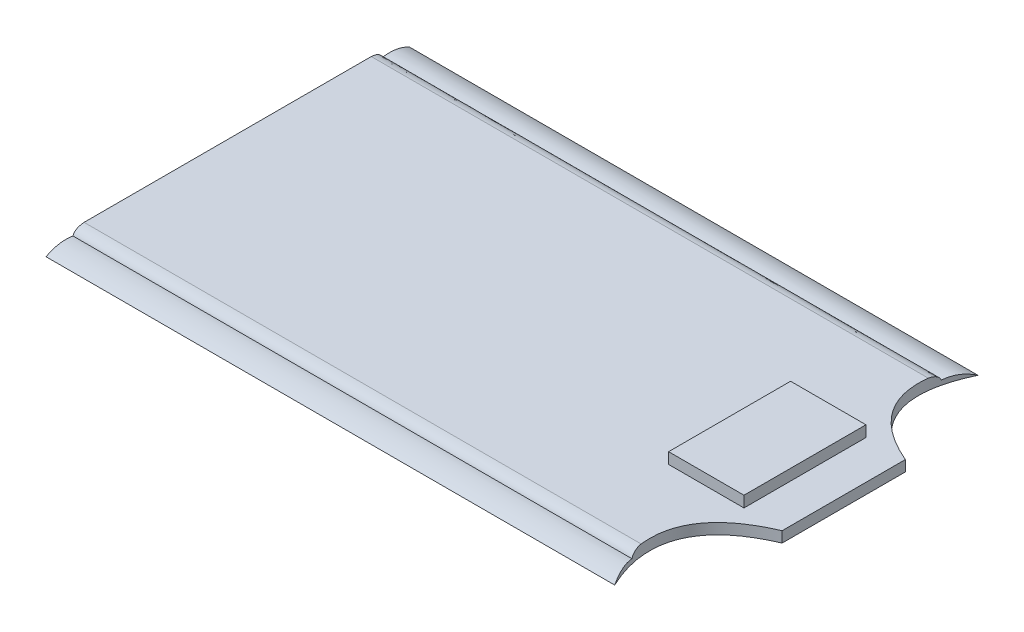
from build123d import *

# Parameters (mm, degrees)
SKETCH1_W           = 1150
SKETCH1_H           = 34
BOSS_EXTRUDE1_DEPTH = 1950
CUT_EXTRUDE3_DEPTH  = 1950
CUT_EXTRUDE4_DEPTH  = 1950
SKETCH4_W           = 238.582936687
SKETCH4_H           = 386.127647534
BOSS_EXTRUDE5_DEPTH = 35


with BuildPart() as part:
    # Sketch1 → Boss-Extrude1 (new body)
    with BuildSketch(Plane(origin=(0, 0, 0), x_dir=(0, 0, -1), z_dir=(1, 0, 0))):
        Rectangle(SKETCH1_W, SKETCH1_H)
    extrude(amount=BOSS_EXTRUDE1_DEPTH)

    # Sketch2 → Cut-Extrude3 (cut)
    with BuildSketch(Plane(origin=(1950, 0, 0), x_dir=(0, 0, -1), z_dir=(1, 0, 0))):
        with BuildLine():
            Line((454.506922221, 17), (575, 17))
            Line((575, 17), (575, -17))
            add(Edge.make_bspline(
                [(489.682610702, -2.777028038), (534.776362322, 4.522431825), (575, -17)],
                knots=[0, 0, 0, 1, 1, 1], degree=2))
            add(Edge.make_bspline(
                [(454.506922221, 17), (483.149171875, 14.577610521), (489.682610702, -2.777028038)],
                knots=[0, 0, 0, 0.737774991, 0.737774991, 0.737774991], degree=2))
        make_face()
        with BuildLine():
            Line((-454.506922221, 17), (-575, 17))
            Line((-575, 17), (-575, -17))
            add(Edge.make_bspline(
                [(-489.682610702, -2.777028038), (-534.776362322, 4.522431825), (-575, -17)],
                knots=[0, 0, 0, 1, 1, 1], degree=2))
            add(Edge.make_bspline(
                [(-454.506922221, 17), (-483.149171875, 14.577610521), (-489.682610702, -2.777028038)],
                knots=[0, 0, 0, 0.737774991, 0.737774991, 0.737774991], degree=2))
        make_face()
    extrude(amount=-CUT_EXTRUDE3_DEPTH, mode=Mode.SUBTRACT)

    # Sketch3 → Cut-Extrude4 (cut)
    with BuildSketch(Plane.XZ.offset(17)):
        with BuildLine():
            Line((1800, 575), (1950, 575))
            Line((1950, 575), (1950, 195))
            add(Edge.make_bspline(
                [(1950, 195), (1676.162586963, 312.417807061), (1800, 575)],
                knots=[0, 0, 0, 1, 1, 1], degree=2))
        make_face()
        with BuildLine():
            Line((1950, -195), (1950, -575))
            Line((1950, -575), (1800, -575))
            add(Edge.make_bspline(
                [(1950, -195), (1676.162586963, -312.417807061), (1800, -575)],
                knots=[0, 0, 0, 1, 1, 1], degree=2))
        make_face()
    extrude(amount=-CUT_EXTRUDE4_DEPTH, mode=Mode.SUBTRACT)

    # Sketch4 → Boss-Extrude5 (add)
    with BuildSketch(Plane(origin=(0, 17, 0), x_dir=(1, 0, 0), z_dir=(0, 1, 0))):
        with Locations((1708.01468048, 0)):
            Rectangle(SKETCH4_W, SKETCH4_H)
    extrude(amount=BOSS_EXTRUDE5_DEPTH)


solid = part.part
